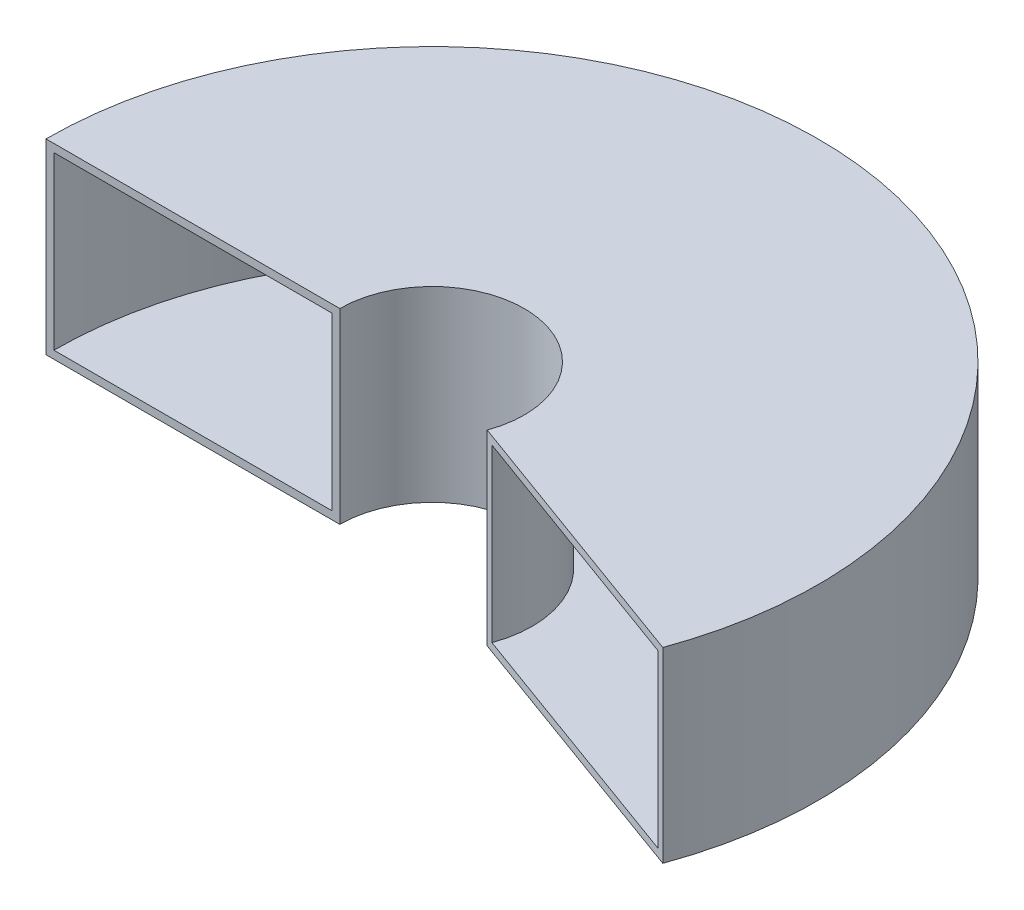
from build123d import *

# Parameters (mm, degrees)
SKETCH2_W           = 94.275056846
SKETCH2_H           = 59.98986983
SKETCH2_W_2         = 89.195056846
SKETCH2_H_2         = 54.90986983
REVOLVE_THIN1_ANGLE = 200


with BuildPart() as part:
    # Sketch2 → Revolve-Thin1 (revolve)
    with BuildSketch(Plane.XY):
        with Locations((-34.686966551, 11.785533037)):
            Rectangle(SKETCH2_W, SKETCH2_H)
        with Locations((-34.686966551, 11.785533037)):
            Rectangle(SKETCH2_W_2, SKETCH2_H_2, mode=Mode.SUBTRACT)
    revolve(axis=Axis((42.052924699, 43.793969352, 0), (0, -1, 0)), revolution_arc=REVOLVE_THIN1_ANGLE)


solid = part.part
